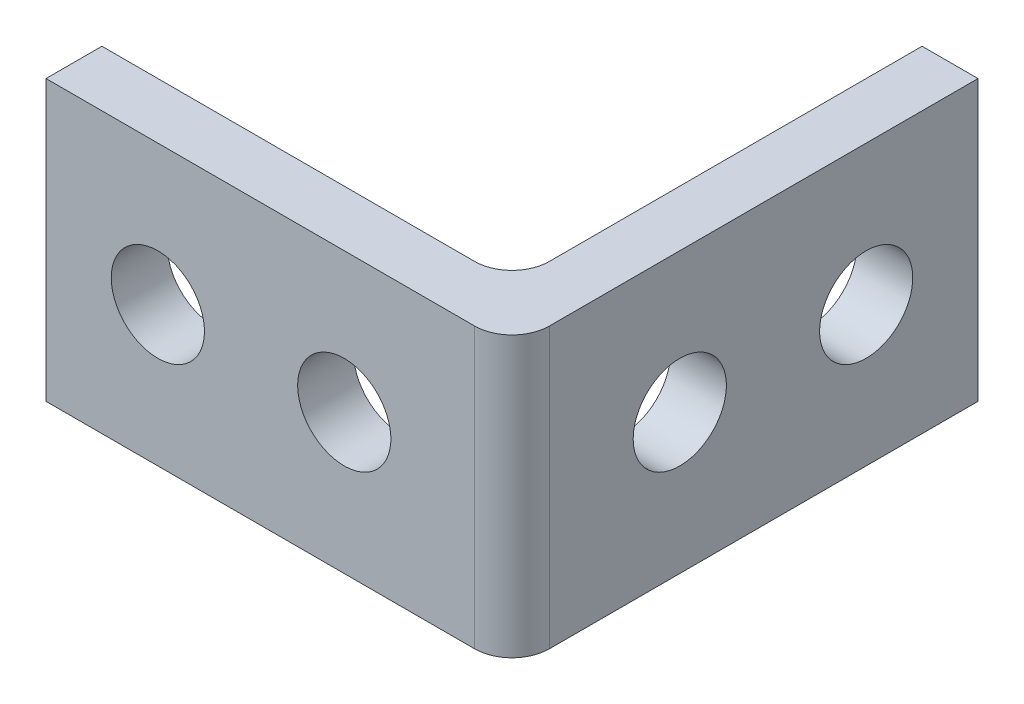
from build123d import *

# Parameters (mm, degrees)
SALIENTE_EXTRUIR1_DEPTH = 15
CROQUIS2_R              = 2.5
CORTAR_EXTRUIR1_DEPTH   = 20
CROQUIS3_R              = 2.5
CORTAR_EXTRUIR2_DEPTH   = 15


with BuildPart() as part:
    # Croquis1 → Saliente-Extruir1 (new body)
    with BuildSketch(Plane(origin=(0, 0, 0), x_dir=(1, 0, 0), z_dir=(0, 1, 0))):
        with BuildLine():
            Line((0, 0), (23, 0))
            ThreePointArc((23, 0), (24.414213562, 0.585786438), (25, 2))
            Line((25, 2), (25, 25))
            Line((25, 25), (22, 25))
            Line((22, 25), (22, 5))
            ThreePointArc((22, 5), (21.414213562, 3.585786438), (20, 3))
            Line((20, 3), (0, 3))
            Line((0, 3), (0, 0))
        make_face()
    extrude(amount=SALIENTE_EXTRUIR1_DEPTH)

    # Croquis2 → Cortar-Extruir1 (cut)
    with BuildSketch(Plane(origin=(0, 0, -3), x_dir=(-1, 0, 0), z_dir=(0, 0, -1))):
        with Locations((-16, 7.5)):
            Circle(CROQUIS2_R)
        with Locations((-6, 7.5)):
            Circle(CROQUIS2_R)
    extrude(amount=-CORTAR_EXTRUIR1_DEPTH, mode=Mode.SUBTRACT)

    # Croquis3 → Cortar-Extruir2 (cut)
    with BuildSketch(Plane.ZY.offset(-22)):
        with Locations((-9, 7.5)):
            Circle(CROQUIS3_R)
        with Locations((-19, 7.5)):
            Circle(CROQUIS3_R)
    extrude(amount=-CORTAR_EXTRUIR2_DEPTH, mode=Mode.SUBTRACT)


solid = part.part
